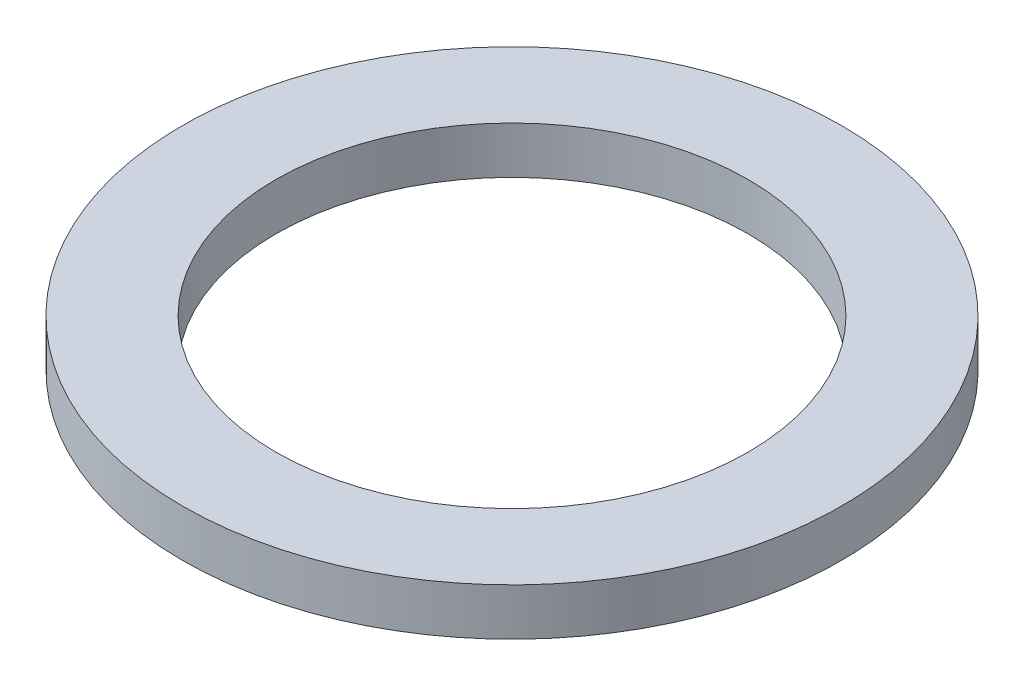
from build123d import *

# Parameters (mm, degrees)
SKETCH1_R           = 11.1125
SKETCH1_R_2         = 7.9629
BOSS_EXTRUDE1_DEPTH = 1.5875


with BuildPart() as part:
    # Sketch1 → Boss-Extrude1 (new body)
    with BuildSketch(Plane(origin=(0, 0, 0), x_dir=(1, 0, 0), z_dir=(0, 1, 0))):
        with Locations(Location((0, 0, 0), (0, 0, 270))):
            Circle(SKETCH1_R)
        with Locations(Location((0, 0, 0), (0, 0, 270))):
            Circle(SKETCH1_R_2, mode=Mode.SUBTRACT)
    extrude(amount=BOSS_EXTRUDE1_DEPTH)


solid = part.part
